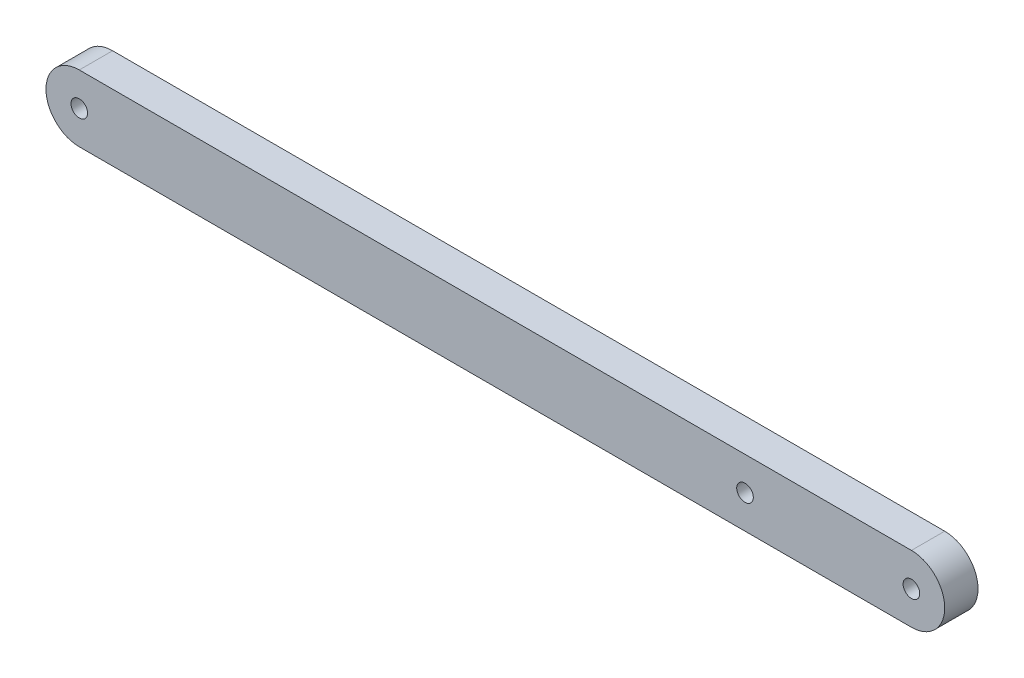
from build123d import *

# Parameters (mm, degrees)
SKETCH1_R           = 2.5
BOSS_EXTRUDE1_DEPTH = 10


with BuildPart() as part:
    # Sketch1 → Boss-Extrude1 (new body)
    with BuildSketch(Plane.XY):
        with BuildLine():
            Line((50, 10), (-200, 10))
            ThreePointArc((-200, 10), (-210, 0), (-200, -10))
            Line((-200, -10), (50, -10))
            ThreePointArc((50, -10), (60, 0), (50, 10))
        make_face()
        Circle(SKETCH1_R, mode=Mode.SUBTRACT)
        with Locations((50, 0)):
            Circle(SKETCH1_R, mode=Mode.SUBTRACT)
        with Locations((-200, 0)):
            Circle(SKETCH1_R, mode=Mode.SUBTRACT)
    extrude(amount=BOSS_EXTRUDE1_DEPTH)


solid = part.part
